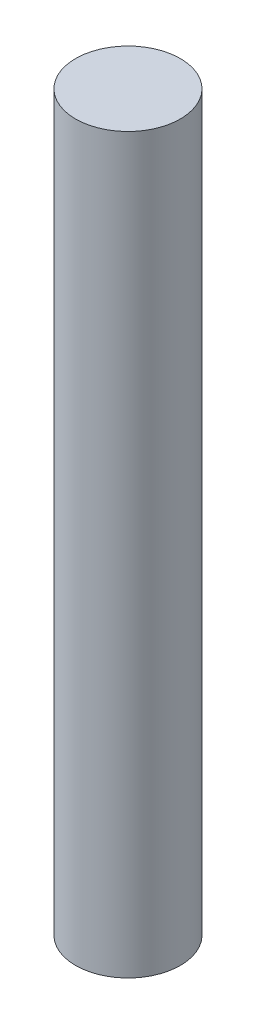
from build123d import *

# Parameters (mm, degrees)
SKETCH1_R           = 2.5
BOSS_EXTRUDE1_DEPTH = 35


with BuildPart() as part:
    # Sketch1 → Boss-Extrude1 (new body)
    with BuildSketch(Plane(origin=(0, 0, 0), x_dir=(1, 0, 0), z_dir=(0, 1, 0))):
        with Locations(Location((0, 0, 0), (0, 0, 270))):
            Circle(SKETCH1_R)
    extrude(amount=BOSS_EXTRUDE1_DEPTH)


solid = part.part
